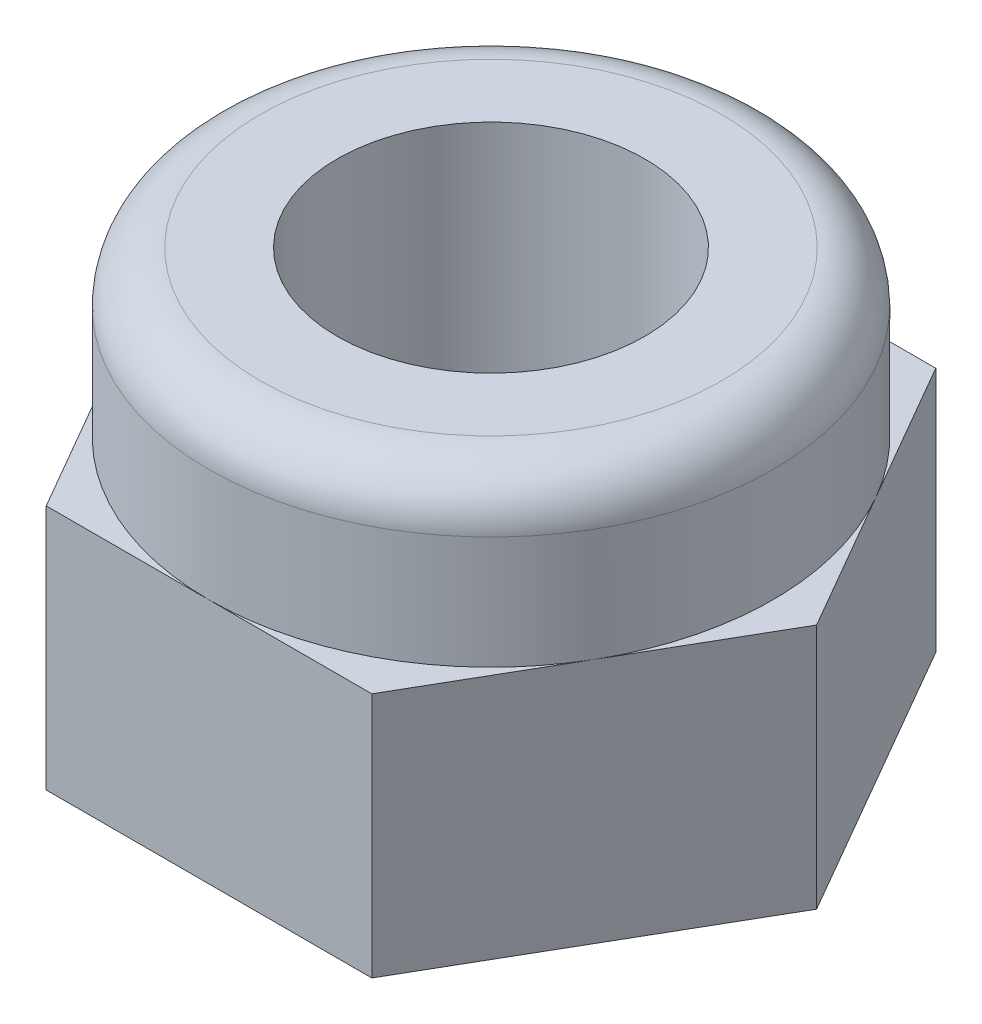
from build123d import *

# Parameters (mm, degrees)
ESQUISSE1_R        = 1.5
BOSS_EXTRU_1_DEPTH = 2.4
ESQUISSE2_R        = 2.75
ESQUISSE2_R_2      = 1.5
BOSS_EXTRU_2_DEPTH = 1.6
CONG_1_R           = 0.5


with BuildPart() as part:
    # Esquisse1 → Boss.-Extru.1 (new body)
    with BuildSketch(Plane(origin=(0, 0, 0), x_dir=(1, 0, 0), z_dir=(0, 1, 0))):
        Polygon((3.175426481, 0), (1.58771324, 2.75), (-1.58771324, 2.75), (-3.175426481, 0), (-1.58771324, -2.75), (1.58771324, -2.75), align=None)
        with Locations(Location((0, 0, 0), (0, 0, 270))):
            Circle(ESQUISSE1_R, mode=Mode.SUBTRACT)
    extrude(amount=BOSS_EXTRU_1_DEPTH)

    # Esquisse2 → Boss.-Extru.2 (add)
    with BuildSketch(Plane(origin=(0, 2.4, 0), x_dir=(1, 0, 0), z_dir=(0, 1, 0))):
        with Locations(Location((0, 0, 0), (0, 0, 270))):
            Circle(ESQUISSE2_R)
        with Locations(Location((0, 0, 0), (0, 0, 270))):
            Circle(ESQUISSE2_R_2, mode=Mode.SUBTRACT)
    extrude(amount=BOSS_EXTRU_2_DEPTH)

    # Congé1
    cong_1_edges = [part.edges().sort_by_distance(p)[0] for p in [
        (0, 4, -2.75),
    ]]
    fillet(cong_1_edges, radius=CONG_1_R)


solid = part.part
